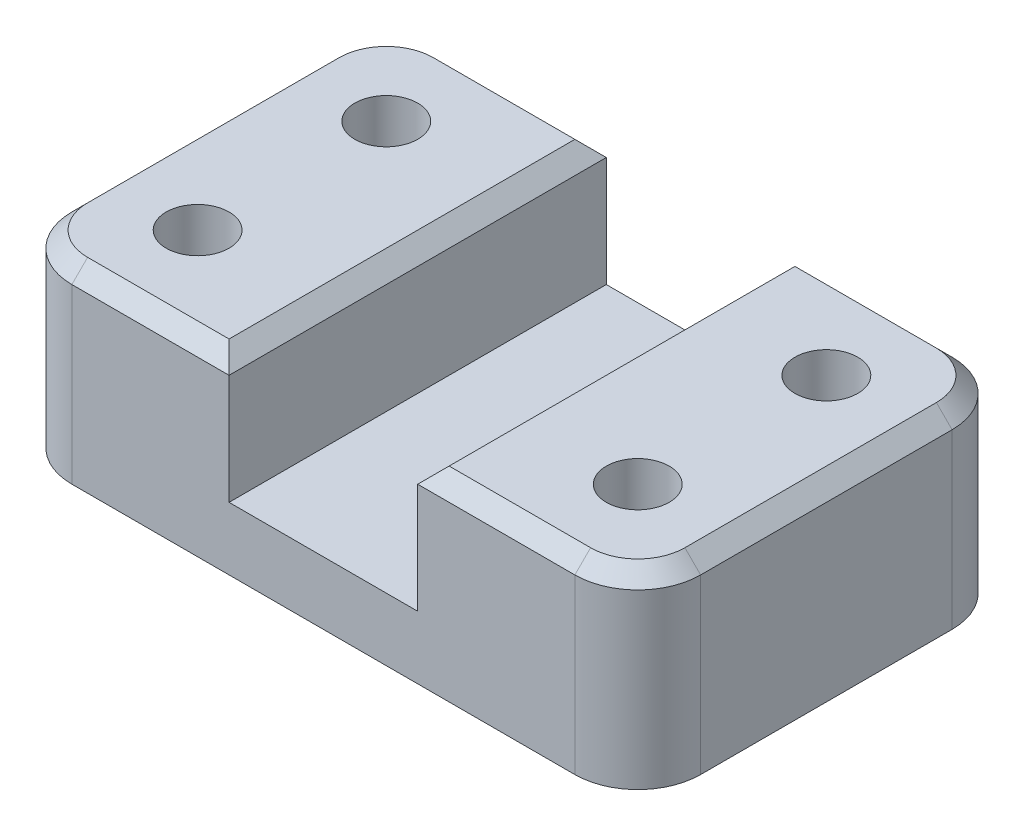
from build123d import *

# Parameters (mm, degrees)
SKETCH1_W           = 5000
SKETCH1_H           = 3000
SKETCH1_R           = 250
BOSS_EXTRUDE1_DEPTH = 1500
SKETCH2_W           = 1500
SKETCH2_H           = 3000
CUT_EXTRUDE1_DEPTH  = 1000
FILLET1_R           = 500
CHAMFER1_SIZE       = 125


with BuildPart() as part:
    # Sketch1 → Boss-Extrude1 (new body)
    with BuildSketch(Plane(origin=(0, 0, 0), x_dir=(1, 0, 0), z_dir=(0, 1, 0))):
        Rectangle(SKETCH1_W, SKETCH1_H)
        with Locations(Location((-1750, 750, 0), (0, 0, 270))):
            Circle(SKETCH1_R, mode=Mode.SUBTRACT)
        with Locations(Location((1750, 750, 0), (0, 0, 90))):
            Circle(SKETCH1_R, mode=Mode.SUBTRACT)
        with Locations(Location((1750, -750, 0), (0, 0, 270))):
            Circle(SKETCH1_R, mode=Mode.SUBTRACT)
        with Locations(Location((-1750, -750, 0), (0, 0, 90))):
            Circle(SKETCH1_R, mode=Mode.SUBTRACT)
    extrude(amount=BOSS_EXTRUDE1_DEPTH)

    # Sketch2 → Cut-Extrude1 (cut)
    with BuildSketch(Plane(origin=(0, 1500, 0), x_dir=(1, 0, 0), z_dir=(0, 1, 0))):
        Rectangle(SKETCH2_W, SKETCH2_H)
    extrude(amount=-CUT_EXTRUDE1_DEPTH, mode=Mode.SUBTRACT)

    # Fillet1
    fillet1_edges = [part.edges().sort_by_distance(p)[0] for p in [
        (2500, 750, 1500),
        (-2500, 750, 1500),
        (-2500, 750, -1500),
        (2500, 750, -1500),
    ]]
    fillet(fillet1_edges, radius=FILLET1_R)

    # Chamfer1
    chamfer1_edges = [part.edges().sort_by_distance(p)[0] for p in [
        (1375, 1500, 1500),
        (-1375, 1500, -1500),
        (-750, 1500, 0),
        (750, 1500, 0),
        (-2500, 1500, 0),
        (1375, 1500, -1500),
        (-1375, 1500, 1500),
        (-2353.553390593, 1500, 1353.553390593),
        (-2353.553390593, 1500, -1353.553390593),
        (2500, 1500, 0),
        (2353.553390593, 1500, 1353.553390593),
        (2353.553390593, 1500, -1353.553390593),
    ]]
    chamfer(chamfer1_edges, length=CHAMFER1_SIZE)


solid = part.part
